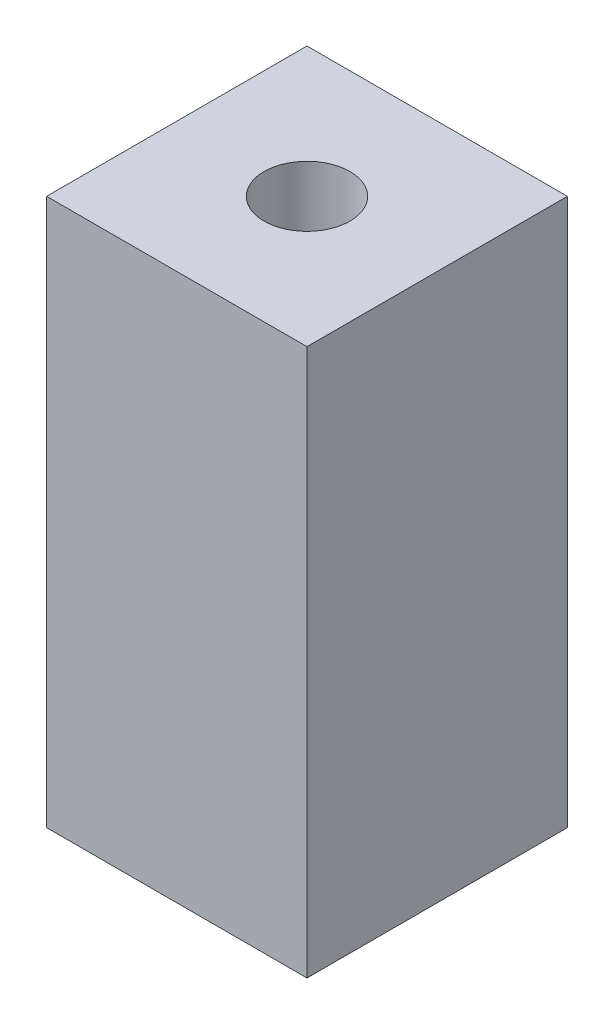
from build123d import *

# Parameters (mm, degrees)
SKETCH_1_W      = 5
SKETCH_1_H      = 5
SKETCH_1_R      = 0.825
EXTRUDE_1_DEPTH = 10.5


with BuildPart() as part:
    # 草图1 → 凸台-拉伸1 (new body)
    with BuildSketch(Plane(origin=(0, 0, 0), x_dir=(1, 0, 0), z_dir=(0, 1, 0))):
        Rectangle(SKETCH_1_W, SKETCH_1_H)
        with Locations(Location((0, 0, 0), (0, 0, 90))):
            Circle(SKETCH_1_R, mode=Mode.SUBTRACT)
    extrude(amount=EXTRUDE_1_DEPTH)


solid = part.part
